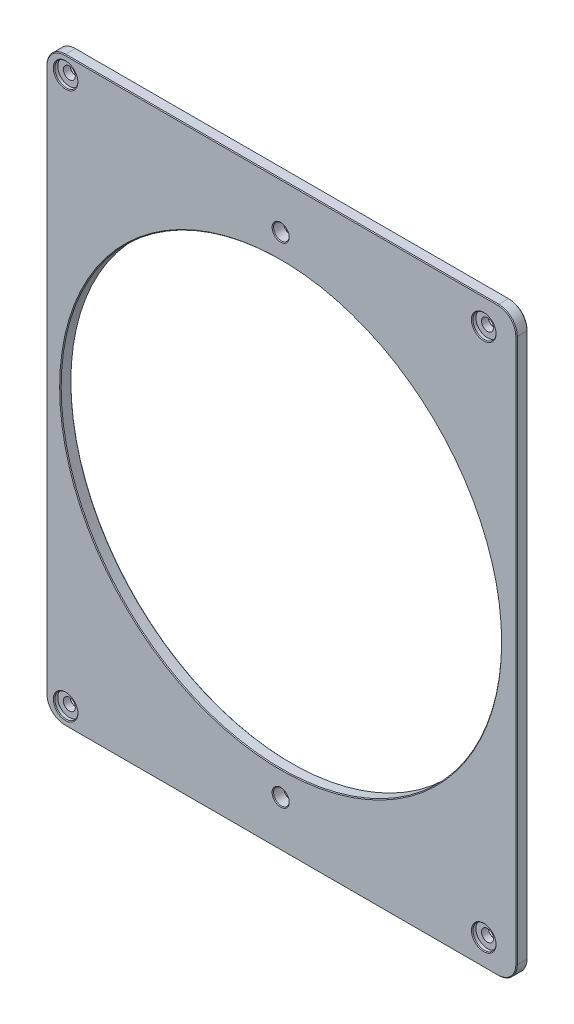
from build123d import *

# Parameters (mm, degrees)
SKETCH_1_R          = 59.1
SKETCH_1_R_2        = 1.6
EXTRUDE_1_DEPTH     = 3
SKETCH_2_R          = 2.1
CUT_EXTRUDE_1_DEPTH = 104.064494371
SKETCH_3_R          = 3.1
CUT_EXTRUDE_2_DEPTH = 1
CHAMFER_1_SIZE      = 0.2


with BuildPart() as part:
    # 草图1 → 凸台-拉伸1 (new body)
    with BuildSketch(Plane.XY):
        with BuildLine():
            Line((62.3, -78), (-53.9, -78))
            ThreePointArc((-53.9, -78), (-57.435533906, -76.535533906), (-58.9, -73))
            Line((-58.9, -73), (-58.9, 73))
            ThreePointArc((-58.9, 73), (-57.435533906, 76.535533906), (-53.9, 78))
            Line((-53.9, 78), (62.3, 78))
            ThreePointArc((62.3, 78), (65.835533906, 76.535533906), (67.3, 73))
            Line((67.3, 73), (67.3, -73))
            ThreePointArc((67.3, -73), (65.835533906, -76.535533906), (62.3, -78))
        make_face()
        with Locations((4, 0)):
            Circle(SKETCH_1_R, mode=Mode.SUBTRACT)
        with Locations((58.493442579, 70.964337058)):
            Circle(SKETCH_1_R_2, mode=Mode.SUBTRACT)
        with Locations((-53.705008218, 73.348219362)):
            Circle(SKETCH_1_R_2, mode=Mode.SUBTRACT)
        with Locations(Location((58.493442579, -70.964337058, 0), (0, 0, 180))):
            Circle(SKETCH_1_R_2, mode=Mode.SUBTRACT)
        with Locations(Location((-53.705008218, -73.348219362, 0), (0, 0, 180))):
            Circle(SKETCH_1_R_2, mode=Mode.SUBTRACT)
    extrude(amount=EXTRUDE_1_DEPTH)

    # 草图2 → 切除-拉伸1 (cut, through all)
    with BuildSketch(Plane.XY.offset(3)):
        with Locations((4, -65.65)):
            Circle(SKETCH_2_R)
        with Locations((4, 65.65)):
            Circle(SKETCH_2_R)
    extrude(amount=-CUT_EXTRUDE_1_DEPTH, mode=Mode.SUBTRACT)

    # 草图3 → 切除-拉伸2 (cut)
    with BuildSketch(Plane.XY.offset(3)):
        with Locations((58.493442579, -70.964337058)):
            Circle(SKETCH_3_R)
        with Locations((-53.705008218, -73.348219362)):
            Circle(SKETCH_3_R)
        with Locations(Location((-53.705008218, 73.348219362, 0), (0, 0, 180))):
            Circle(SKETCH_3_R)
        with Locations(Location((58.493442579, 70.964337058, 0), (0, 0, 180))):
            Circle(SKETCH_3_R)
    extrude(amount=-CUT_EXTRUDE_2_DEPTH, mode=Mode.SUBTRACT)

    # 倒角1
    chamfer_1_edges = [part.edges().sort_by_distance(p)[0] for p in [
        (4.2, 78, 0),
        (65.835533906, 76.535533906, 0),
        (67.3, 0, 0),
        (65.835533906, -76.535533906, 0),
        (65.835533906, 76.535533906, 3),
        (4.2, 78, 3),
        (-57.435533906, 76.535533906, 3),
        (-55.1, 0, 0),
        (-55.1, 0, 3),
        (-58.9, 0, 3),
        (56.893442579, 70.964337058, 0),
        (-57.435533906, -76.535533906, 3),
        (60.093442579, -70.964337058, 0),
        (4.2, -78, 3),
        (-55.305008218, 73.348219362, 0),
        (-52.105008218, -73.348219362, 0),
        (65.835533906, -76.535533906, 3),
        (1.9, -65.65, 0),
        (1.9, -65.65, 3),
        (1.9, 65.65, 0),
        (1.9, 65.65, 3),
        (61.593442579, 70.964337058, 3),
        (-50.605008218, 73.348219362, 3),
        (-56.805008218, -73.348219362, 3),
        (55.393442579, -70.964337058, 3),
        (4.2, -78, 0),
        (67.3, 0, 3),
        (-57.435533906, -76.535533906, 0),
        (-58.9, 0, 0),
        (-57.435533906, 76.535533906, 0),
    ]]
    chamfer(chamfer_1_edges, length=CHAMFER_1_SIZE)


solid = part.part
